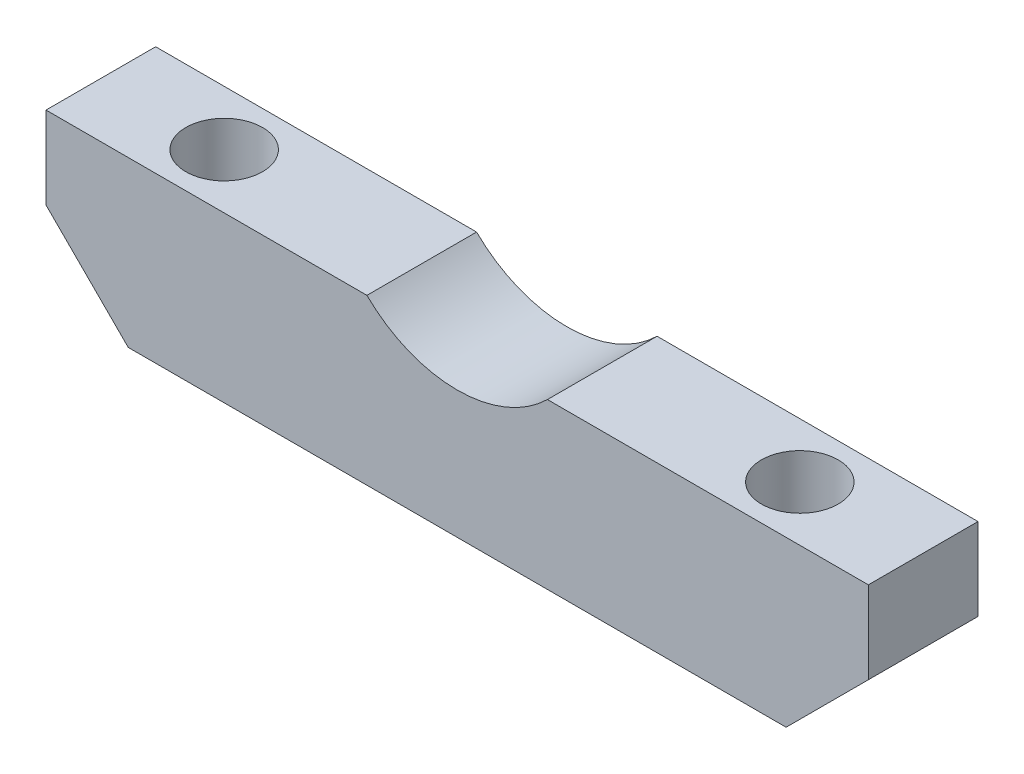
from build123d import *

# Parameters (mm, degrees)
SKETCH_1_W             = 30
SKETCH_1_H             = 13
EXTRUDE_1_DEPTH        = 4
SKETCH_3_R             = 4.7
CUT_EXTRUDE_2_DEPTH    = 10
HOLE_WIZARD_M2_1_D     = 1.6
HOLE_WIZARD_M2_1_DEPTH = 6
HOLE_WIZARD_M2_1_TIP   = 0.480688495
SKETCH_7_W             = 30
SKETCH_7_H             = 7
CUT_EXTRUDE_3_DEPTH    = 10
CHAMFER_1_SIZE         = 3
SKETCH_8_R             = 1.4
CUT_EXTRUDE_4_DEPTH    = 10


with BuildPart() as part:
    # 草图1 → 凸台-拉伸1 (new body)
    with BuildSketch(Plane.XY):
        Rectangle(SKETCH_1_W, SKETCH_1_H)
    extrude(amount=EXTRUDE_1_DEPTH)

    # 草图3 → 切除-拉伸2 (cut)
    with BuildSketch(Plane.XY.offset(4)):
        with Locations((0, 9.854101966)):
            Circle(SKETCH_3_R)
    extrude(amount=-CUT_EXTRUDE_2_DEPTH, mode=Mode.SUBTRACT)

    # M2 螺纹孔1
    with Locations(Plane(origin=(0, -0.645898034, 4), x_dir=(1, 0, 0), z_dir=(0, 0, 1))):
        with Locations((0, 0)):
            Hole(HOLE_WIZARD_M2_1_D / 2, depth=HOLE_WIZARD_M2_1_DEPTH)
            with Locations((0, 0, -(HOLE_WIZARD_M2_1_DEPTH + HOLE_WIZARD_M2_1_TIP / 2))):  # 118° drill point
                Cone(0, HOLE_WIZARD_M2_1_D / 2, HOLE_WIZARD_M2_1_TIP, mode=Mode.SUBTRACT)

    # 草图7 → 切除-拉伸3 (cut)
    with BuildSketch(Plane.XY.offset(4)):
        with Locations((0, -3)):
            Rectangle(SKETCH_7_W, SKETCH_7_H)
    extrude(amount=-CUT_EXTRUDE_3_DEPTH, mode=Mode.SUBTRACT)

    # 倒角1
    chamfer_1_edges = [part.edges().sort_by_distance(p)[0] for p in [
        (-15, 0.5, 2),
        (15, 0.5, 2),
    ]]
    chamfer(chamfer_1_edges, length=CHAMFER_1_SIZE)

    # 草图8 → 切除-拉伸4 (cut)
    with BuildSketch(Plane.XZ.offset(-0.5)):
        with Locations(Location((-10.5, 2, 0), (0, 0, 270))):
            Circle(SKETCH_8_R)
    cut_extrude_4 = extrude(amount=-CUT_EXTRUDE_4_DEPTH, mode=Mode.SUBTRACT)

    # 镜向1: 切除-拉伸4 across plane
    add(cut_extrude_4.mirror(Plane(origin=(0, 0, 0), x_dir=(0, 0, 1), z_dir=(1, 0, 0))), mode=Mode.SUBTRACT)


solid = part.part
